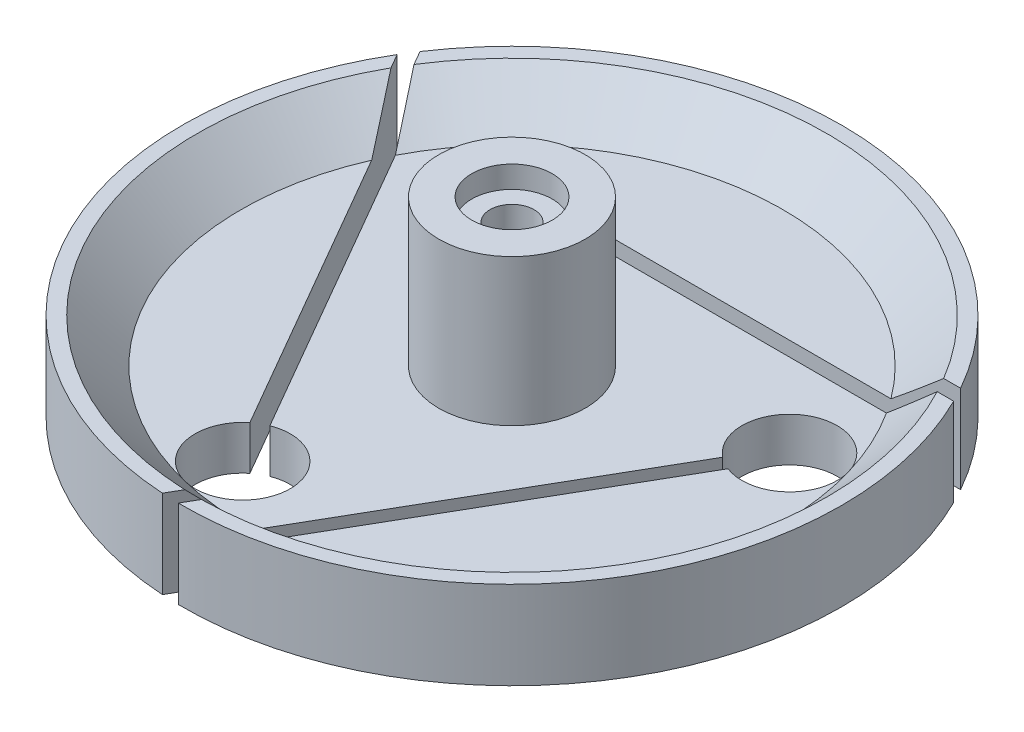
from build123d import *

# Parameters (mm, degrees)
CUT_EXTRUDE_1_DEPTH      = 67.708320321
PATTERN_CIRCULAR_1_COUNT = 3


with BuildPart() as part:
    # 草图1 → 旋转1 (revolve)
    with BuildSketch(Plane.XY, mode=Mode.PRIVATE) as revolve_1_sk:
        Polygon((10, 26), (10, 6), (37, 6), (43, 12), (45, 12), (45, 0), (3, 0), (3, 23), (5.5, 23), (5.5, 26), align=None)
    revolve(revolve_1_sk.sketch.rotate(Axis((0, 83.728815318, 0), (0, -1, 0)), 90), axis=Axis((0, 83.728815318, 0), (0, -1, 0)))

    # 草图2 → 切除-拉伸1 (cut, symmetric)
    with BuildSketch(Plane(origin=(0, 6, 0), x_dir=(1, 0, 0), z_dir=(0, 1, 0))):
        with BuildLine():
            Line((-15.696380071, 22), (39.255572853, 22))
            ThreePointArc((39.255572853, 22), (39.795996859, 21.006633096), (40.311288741, 20))
            Line((40.311288741, 20), (-15.696380071, 20))
            ThreePointArc((-15.696380071, 20), (-28.618996361, 21), (-15.696380071, 22))
        make_face()
    cut_extrude_1 = extrude(amount=CUT_EXTRUDE_1_DEPTH, both=True, mode=Mode.SUBTRACT)

    # 阵列(圆周)1: 切除-拉伸1 ×3 about axis
    pattern_circular_1_axis = Axis((0, 0, 0), (0, 1, 0))
    for i in range(1, PATTERN_CIRCULAR_1_COUNT):
        add(cut_extrude_1.rotate(pattern_circular_1_axis, i * 360 / PATTERN_CIRCULAR_1_COUNT), mode=Mode.SUBTRACT)


solid = part.part
